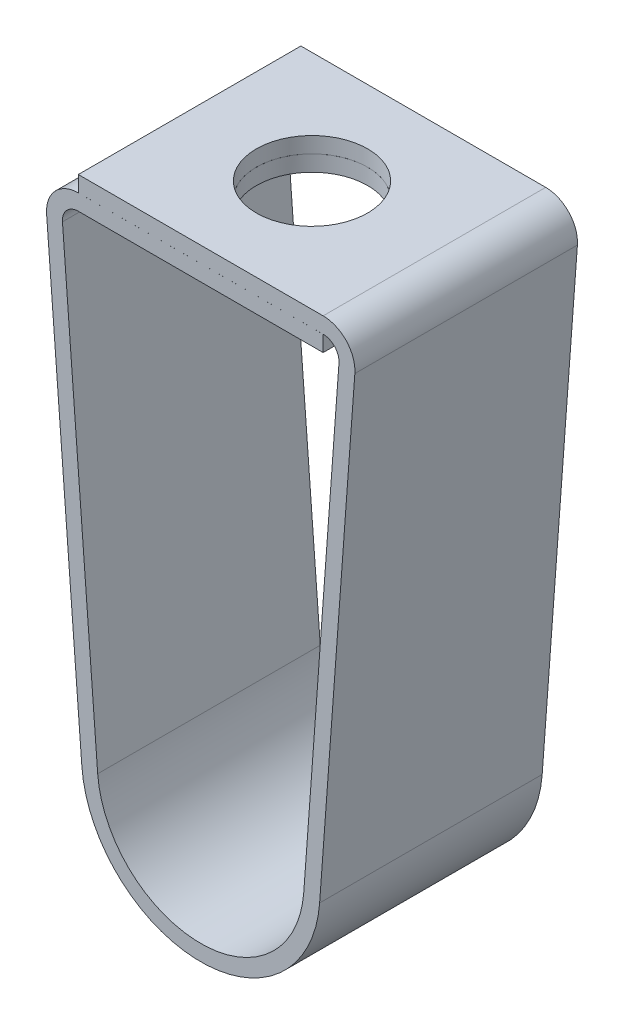
from build123d import *

# Parameters (mm, degrees)
BOSS_EXTRUDE1_DEPTH = 11.1125
SKETCH2_R           = 5.55625
CUT_EXTRUDE1_DEPTH  = 54.549874163


with BuildPart() as part:
    # Sketch1 → Boss-Extrude1 (new, symmetric)
    with BuildSketch(Plane.XY):
        with BuildLine():
            Line((-12.22375, 50.06975), (12.22375, 50.06975))
            ThreePointArc((12.22375, 50.06975), (14.550144612, 49.055424226), (15.390100159, 46.660545659))
            Line((15.390100159, 46.660545659), (11.873813095, -0.878266277))
            ThreePointArc((11.873813095, -0.878266277), (0.015148097, -11.906240364), (-11.871539853, -0.908477065))
            Line((-11.871539853, -0.908477065), (-15.389493961, 45.062449449))
            ThreePointArc((-15.389493961, 45.062449449), (-14.552891714, 47.462422649), (-12.22375, 48.47971))
            Line((-12.22375, 48.47971), (12.22375, 48.47971))
            Line((12.22375, 48.47971), (12.22375, 46.89221))
            Line((12.22375, 46.89221), (-12.22375, 46.89221))
            ThreePointArc((-12.22375, 46.89221), (-13.388320857, 46.383566325), (-13.80662198, 45.183579725))
            Line((-13.80662198, 45.183579725), (-10.288667873, -0.78734679))
            ThreePointArc((-10.288667873, -0.78734679), (0.01312835, -10.318741649), (10.290638015, -0.761164107))
            Line((10.290638015, -0.761164107), (13.806925079, 46.77764783))
            ThreePointArc((13.806925079, 46.77764783), (13.386947306, 47.975087113), (12.22375, 48.48225))
            Line((12.22375, 48.48225), (-12.22375, 48.48225))
            Line((-12.22375, 48.48225), (-12.22375, 50.06975))
        make_face()
    extrude(amount=BOSS_EXTRUDE1_DEPTH, both=True)

    # Sketch2 → Cut-Extrude1 (cut, through all)
    with BuildSketch(Plane(origin=(0, 0, 0), x_dir=(1, 0, 0), z_dir=(0, 1, 0))):
        with Locations(Location((0, 0, 0), (0, 0, 180))):
            Circle(SKETCH2_R)
    extrude(amount=CUT_EXTRUDE1_DEPTH, mode=Mode.SUBTRACT)


solid = part.part
